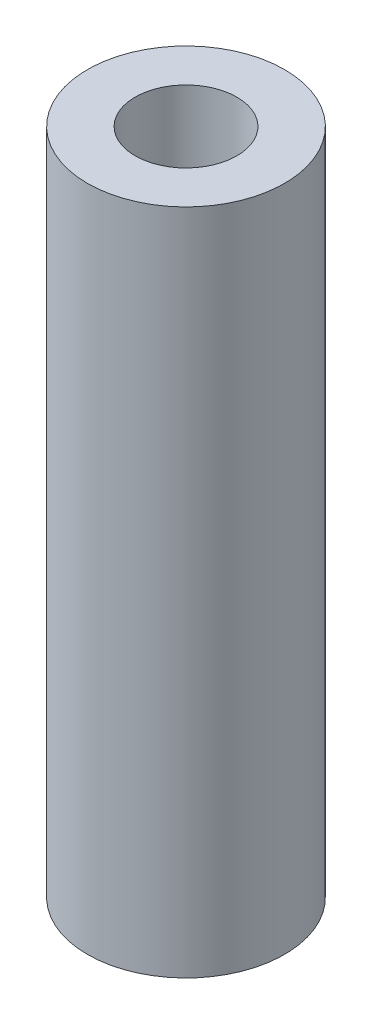
from build123d import *

# Parameters (mm, degrees)
SKETCH1_R           = 3.1
SKETCH1_R_2         = 1.6
BOSS_EXTRUDE1_DEPTH = 21


with BuildPart() as part:
    # Sketch1 → Boss-Extrude1 (new body)
    with BuildSketch(Plane(origin=(0, 0, 0), x_dir=(1, 0, 0), z_dir=(0, 1, 0))):
        with Locations(Location((0, 0, 0), (0, 0, 90))):
            Circle(SKETCH1_R)
        with Locations(Location((0, 0, 0), (0, 0, 90))):
            Circle(SKETCH1_R_2, mode=Mode.SUBTRACT)
    extrude(amount=BOSS_EXTRUDE1_DEPTH)


solid = part.part
